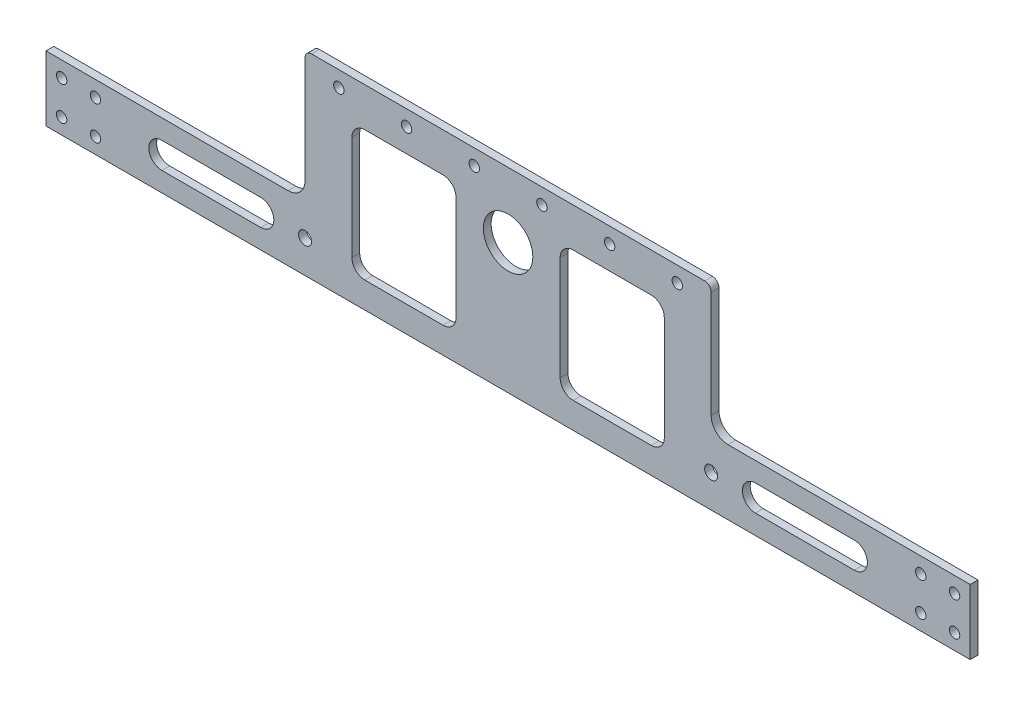
from build123d import *

# Parameters (mm, degrees)
SKETCH1_R           = 9.5
SKETCH1_R_2         = 2
SKETCH1_R_3         = 2.5
BOSS_EXTRUDE1_DEPTH = 1.5


with BuildPart() as part:
    # Sketch1 → Boss-Extrude1 (new, symmetric)
    with BuildSketch(Plane.XY):
        with BuildLine():
            Line((177.5, 0), (177.5, 25))
            Line((177.5, 25), (84.5, 25))
            ThreePointArc((84.5, 25), (79.903805922, 26.903805922), (78, 31.5))
            Line((78, 31.5), (78, 72.5))
            ThreePointArc((78, 72.5), (77.267766953, 74.267766953), (75.5, 75))
            Line((75.5, 75), (-75.5, 75))
            ThreePointArc((-75.5, 75), (-77.267766953, 74.267766953), (-78, 72.5))
            Line((-78, 72.5), (-78, 31.5))
            ThreePointArc((-78, 31.5), (-79.903805922, 26.903805922), (-84.5, 25))
            Line((-84.5, 25), (-177.5, 25))
            Line((-177.5, 25), (-177.5, 0))
            Line((-177.5, 0), (177.5, 0))
        make_face()
        with Locations((0, 50)):
            Circle(SKETCH1_R, mode=Mode.SUBTRACT)
        with Locations((-65, 69)):
            Circle(SKETCH1_R_2, mode=Mode.SUBTRACT)
        with Locations((-39, 69)):
            Circle(SKETCH1_R_2, mode=Mode.SUBTRACT)
        with Locations((-13, 69)):
            Circle(SKETCH1_R_2, mode=Mode.SUBTRACT)
        with Locations((13, 69)):
            Circle(SKETCH1_R_2, mode=Mode.SUBTRACT)
        with Locations((39, 69)):
            Circle(SKETCH1_R_2, mode=Mode.SUBTRACT)
        with Locations((65, 69)):
            Circle(SKETCH1_R_2, mode=Mode.SUBTRACT)
        with Locations((-78, 12.5)):
            Circle(SKETCH1_R_3, mode=Mode.SUBTRACT)
        with Locations((-171.5, 19)):
            Circle(SKETCH1_R_2, mode=Mode.SUBTRACT)
        with Locations((-158.5, 19)):
            Circle(SKETCH1_R_2, mode=Mode.SUBTRACT)
        with Locations((-171.5, 6)):
            Circle(SKETCH1_R_2, mode=Mode.SUBTRACT)
        with Locations((-158.5, 6)):
            Circle(SKETCH1_R_2, mode=Mode.SUBTRACT)
        with Locations((171.5, 6)):
            Circle(SKETCH1_R_2, mode=Mode.SUBTRACT)
        with Locations((171.5, 19)):
            Circle(SKETCH1_R_2, mode=Mode.SUBTRACT)
        with Locations((158.5, 19)):
            Circle(SKETCH1_R_2, mode=Mode.SUBTRACT)
        with Locations((158.5, 6)):
            Circle(SKETCH1_R_2, mode=Mode.SUBTRACT)
        with Locations((78, 12.5)):
            Circle(SKETCH1_R_3, mode=Mode.SUBTRACT)
        with BuildLine():
            Line((-55, 60), (-25, 60))
            ThreePointArc((-25, 60), (-21.464466094, 58.535533906), (-20, 55))
            Line((-20, 55), (-20, 15))
            ThreePointArc((-20, 15), (-21.464466094, 11.464466094), (-25, 10))
            Line((-25, 10), (-55, 10))
            ThreePointArc((-55, 10), (-58.535533906, 11.464466094), (-60, 15))
            Line((-60, 15), (-60, 55))
            ThreePointArc((-60, 55), (-58.535533906, 58.535533906), (-55, 60))
        make_face(mode=Mode.SUBTRACT)
        with BuildLine():
            Line((-133, 17.5), (-95, 17.5))
            ThreePointArc((-95, 17.5), (-90, 12.5), (-95, 7.5))
            Line((-95, 7.5), (-133, 7.5))
            ThreePointArc((-133, 7.5), (-138, 12.5), (-133, 17.5))
        make_face(mode=Mode.SUBTRACT)
        with BuildLine():
            Line((133, 17.5), (95, 17.5))
            ThreePointArc((95, 17.5), (90, 12.5), (95, 7.5))
            Line((95, 7.5), (133, 7.5))
            ThreePointArc((133, 7.5), (138, 12.5), (133, 17.5))
        make_face(mode=Mode.SUBTRACT)
        with BuildLine():
            Line((55, 10), (25, 10))
            ThreePointArc((25, 10), (21.464466094, 11.464466094), (20, 15))
            Line((20, 15), (20, 55))
            ThreePointArc((20, 55), (21.464466094, 58.535533906), (25, 60))
            Line((25, 60), (55, 60))
            ThreePointArc((55, 60), (58.535533906, 58.535533906), (60, 55))
            Line((60, 55), (60, 15))
            ThreePointArc((60, 15), (58.535533906, 11.464466094), (55, 10))
        make_face(mode=Mode.SUBTRACT)
    extrude(amount=BOSS_EXTRUDE1_DEPTH, both=True)


solid = part.part
